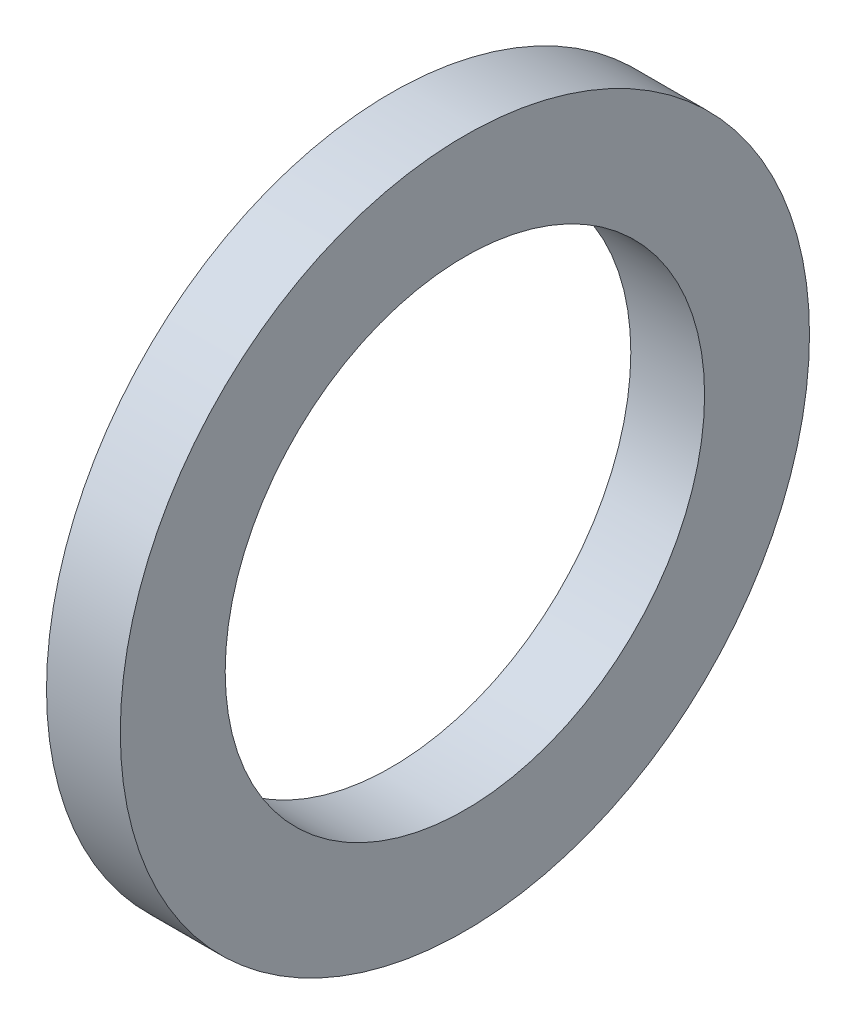
from build123d import *

# Parameters (mm, degrees)
IZIM2_W = 4.120113223
IZIM2_H = 5.857340585


with BuildPart() as part:
    # Çizim2 → Döndür1 (revolve)
    with BuildSketch(Plane(origin=(0, 0, 0), x_dir=(1, 0, 0), z_dir=(0, 1, 0)), mode=Mode.PRIVATE) as d_nd_r1_sk:
        with Locations((2.060056612, 16.313864266)):
            Rectangle(IZIM2_W, IZIM2_H)
    revolve(d_nd_r1_sk.sketch.rotate(Axis((0, 0, 0), (1, 0, 0)), 180), axis=Axis((0, 0, 0), (1, 0, 0)))


solid = part.part
